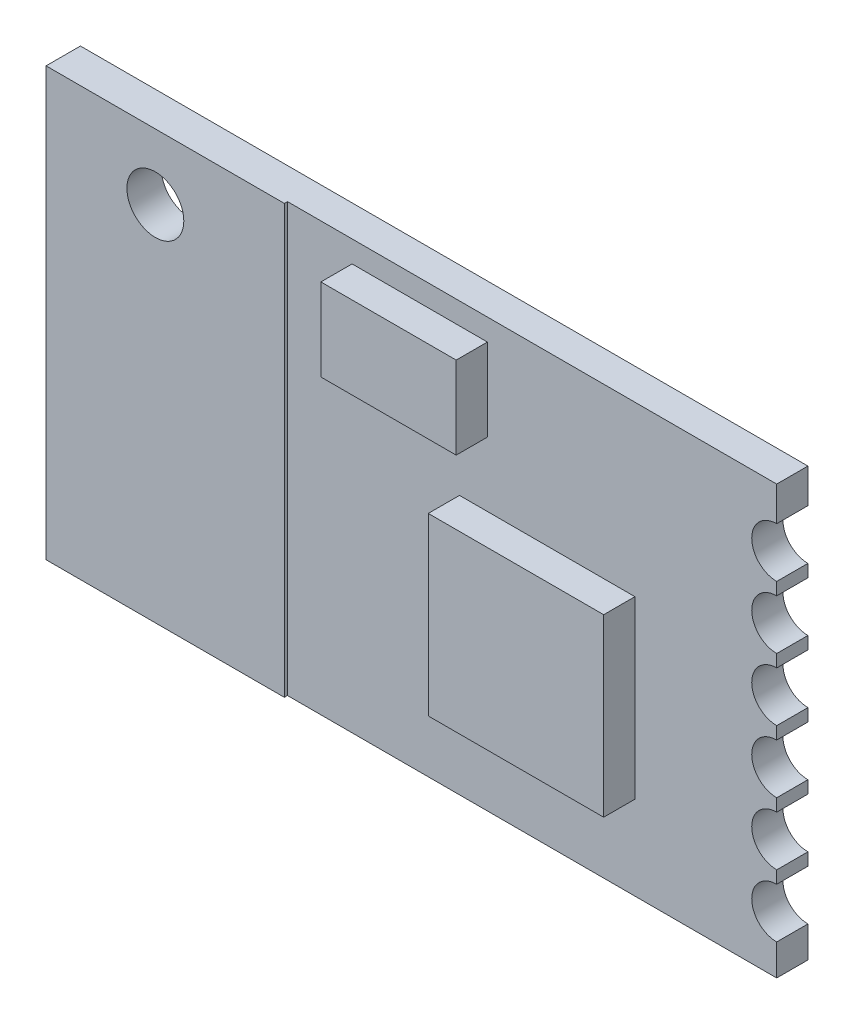
from build123d import *
from build123d.topology import SkipClean

# Parameters (mm, degrees)
SKETCH1_R           = 0.911145061
BOSS_EXTRUDE1_DEPTH = 1
SKETCH2_W           = 7.631466846
SKETCH2_H           = 13.7
BOSS_EXTRUDE2_DEPTH = 0.1
SKETCH3_W           = 5.617836281
SKETCH3_H           = 5.617836281
SKETCH3_W_2         = 4.333759416
SKETCH3_H_2         = 2.636943561
BOSS_EXTRUDE3_DEPTH = 2


with BuildPart() as part:
    # Sketch1 → Boss-Extrude1 (new body)
    with BuildSketch(Plane.XY):
        with BuildLine():
            Line((23.3, -2.7), (23.3, -3.1))
            ThreePointArc((23.3, -3.1), (22.5, -3.9), (23.3, -4.7))
            Line((23.3, -4.7), (23.3, -5.1))
            ThreePointArc((23.3, -5.1), (22.5, -5.9), (23.3, -6.7))
            Line((23.3, -6.7), (23.3, -7.1))
            ThreePointArc((23.3, -7.1), (22.5, -7.9), (23.3, -8.7))
            Line((23.3, -8.7), (23.3, -9.1))
            ThreePointArc((23.3, -9.1), (22.5, -9.9), (23.3, -10.7))
            Line((23.3, -10.7), (23.3, -11.1))
            ThreePointArc((23.3, -11.1), (22.5, -11.9), (23.3, -12.7))
            Line((23.3, -12.7), (23.3, -13.7))
            Line((23.3, -13.7), (0, -13.7))
            Line((0, -13.7), (0, 0))
            Line((0, 0), (23.3, 0))
            Line((23.3, 0), (23.3, -1.1))
            ThreePointArc((23.3, -1.1), (22.5, -1.9), (23.3, -2.7))
        make_face()
        with Locations((3.5, -2.1)):
            Circle(SKETCH1_R, mode=Mode.SUBTRACT)
    extrude(amount=BOSS_EXTRUDE1_DEPTH)

    # Sketch2 → Boss-Extrude2 (add)
    with SkipClean():  # the faces are left unmerged after this step: merging them gives an invalid solid
        with BuildSketch(Plane.XY.offset(1)):
            with Locations((3.815733423, -6.85)):
                Rectangle(SKETCH2_W, SKETCH2_H)
            with BuildLine():
                ThreePointArc((2.952848723, -2.828567637), (3.092783142, -1.284917334), (4.411145061, -2.1))
                ThreePointArc((4.411145061, -2.1), (3.907216858, -2.915082666), (2.952848723, -2.828567637))
            make_face(mode=Mode.SUBTRACT)
        extrude(amount=BOSS_EXTRUDE2_DEPTH)

    # Sketch3 → Boss-Extrude3 (add)
    with SkipClean():  # the faces are left unmerged after this step: merging them gives an invalid solid
        with BuildSketch(Plane.XY):
            with Locations((15.9493645, -8.202866697)):
                Rectangle(SKETCH3_W, SKETCH3_H)
            with Locations((11.867834468, -2.011781816)):
                Rectangle(SKETCH3_W_2, SKETCH3_H_2)
        extrude(amount=BOSS_EXTRUDE3_DEPTH)


solid = part.part
